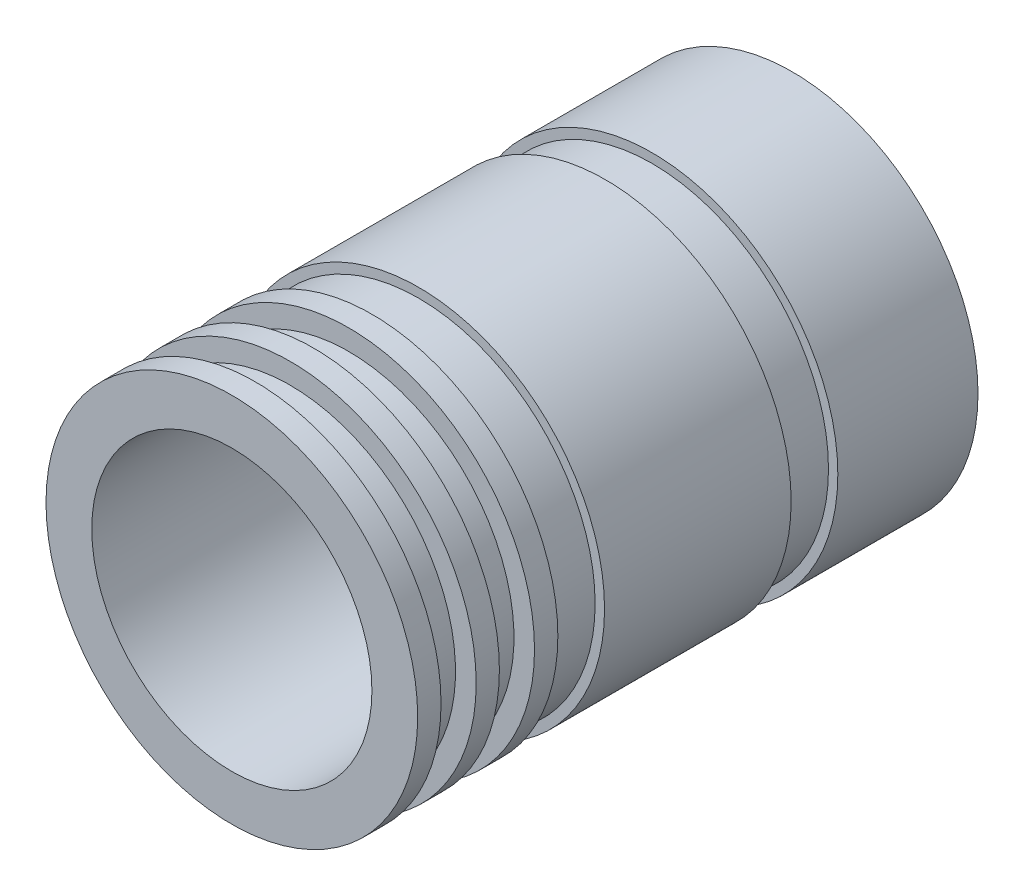
from build123d import *

# Parameters (mm, degrees)
SKETCH1_R           = 25.273
BOSS_EXTRUDE1_DEPTH = 76.2
SKETCH5_R           = 19.05
CUT_EXTRUDE2_DEPTH  = 76.2


with BuildPart() as part:
    # Sketch1 → Boss-Extrude1 (new body)
    with BuildSketch(Plane.XY):
        with Locations(Location((0, 0, 0), (0, 0, 180))):
            Circle(SKETCH1_R)
    extrude(amount=BOSS_EXTRUDE1_DEPTH)

    # Sketch5 → Cut-Extrude2 (cut)
    with BuildSketch(Plane.XY.offset(76.2)):
        Circle(SKETCH5_R)
    extrude(amount=-CUT_EXTRUDE2_DEPTH, mode=Mode.SUBTRACT)

    # Cut-Sweep4: sweep along a path in groove path
    with BuildLine(Plane.XY.offset(60.3123)) as cut_sweep4_path:
        CenterArc((0, 0), 25.273, 0, 360)
    # Groove → Cut-Sweep4 (sweep, cut)
    with BuildSketch(Plane(origin=(0, 0, 0), x_dir=(0, 0, -1), z_dir=(1, 0, 0))):
        Polygon((-73.025, 25.273), (-73.025, 22.479), (-68.2625, 22.479), (-68.244704377, 25.273), (-65.0875, 25.273), (-65.0875, 22.479), (-60.3123, 22.479), (-60.3123, 25.273), (-57.1373, 25.273), (-57.1373, 24.003), (-50.8, 24.003), (-50.7873, 25.273), (-50.7873, 27.723939067), (-73.025, 27.723939067), align=None)
        Polygon((-19.0627, 27.723939067), (-25.4127, 27.723939067), (-25.4127, 25.273), (-25.4, 24.003), (-19.0627, 24.003), (-19.0627, 25.273), align=None)
    sweep(path=cut_sweep4_path.line, mode=Mode.SUBTRACT)

    # Cut-Sweep5: sweep along a path in Sketch14
    with BuildLine(Plane(origin=(0, 0, 11.0656468), x_dir=(-1, 0, 0), z_dir=(0, 0, -1))) as cut_sweep5_path:
        CenterArc((0, 0), 19.05, 0, 360)
    # Sketch6 → Cut-Sweep5 (sweep, cut)
    with BuildSketch(Plane(origin=(0, 0, 0), x_dir=(0, 0, -1), z_dir=(1, 0, 0))):
        Polygon((-3.1281468, 0), (-15.8281468, 0), (-15.8281468, 21.844320112), (-11.1125, 21.844320112), (-11.1125, 18.034), (-7.9375, 18.034), (-7.9375, 21.844), (-3.1281468, 21.844), align=None)
    sweep(path=cut_sweep5_path.line, mode=Mode.SUBTRACT)


solid = part.part
